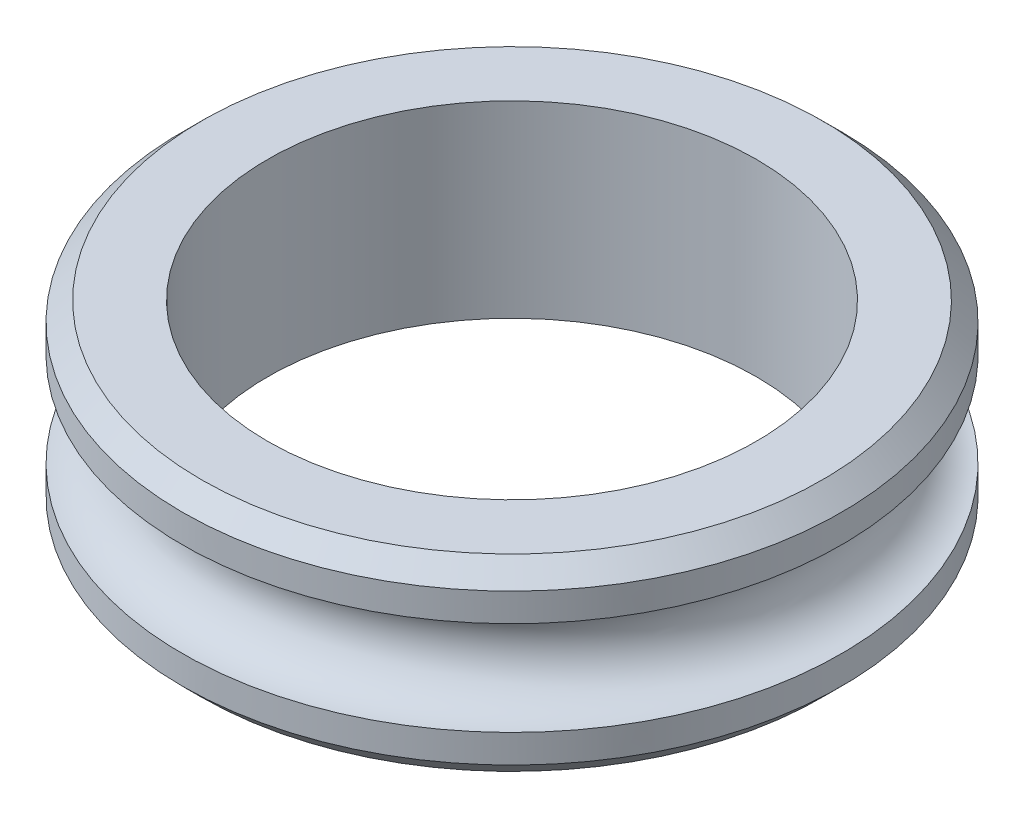
from build123d import *

# Parameters (mm, degrees)
SKETCH1_R                 = 17.5
SKETCH1_R_2               = 12.975
CORPO_EXTERNO_35_10_DEPTH = 10
CHANFROS_1_45_SIZE        = 1


with BuildPart() as part:
    # Sketch1 → Corpo Externo Ø35×10 (new body)
    with BuildSketch(Plane(origin=(0, 0, 0), x_dir=(1, 0, 0), z_dir=(0, 1, 0))):
        with Locations(Location((0, 0, 0), (0, 0, 270))):
            Circle(SKETCH1_R)
        with Locations(Location((0, 0, 0), (0, 0, 270))):
            Circle(SKETCH1_R_2, mode=Mode.SUBTRACT)
    extrude(amount=CORPO_EXTERNO_35_10_DEPTH)

    # Chanfros 1×45°
    chanfros_1_45_edges = [part.edges().sort_by_distance(p)[0] for p in [
        (0, 10, -17.5),
        (0, 0, -17.5),
    ]]
    chamfer(chanfros_1_45_edges, length=CHANFROS_1_45_SIZE)

    # Sketch2 → Canal (revolve, cut)
    with BuildSketch(Plane.XY, mode=Mode.PRIVATE) as canal_sk:
        with BuildLine():
            ThreePointArc((-17.5, 7.5), (-15, 5), (-17.5, 2.5))
            Line((-17.5, 2.5), (-17.5, 7.5))
        make_face()
    revolve(canal_sk.sketch.rotate(Axis((0, 0, 0), (0, 1, 0)), 270), axis=Axis((0, 0, 0), (0, 1, 0)), mode=Mode.SUBTRACT)


solid = part.part
